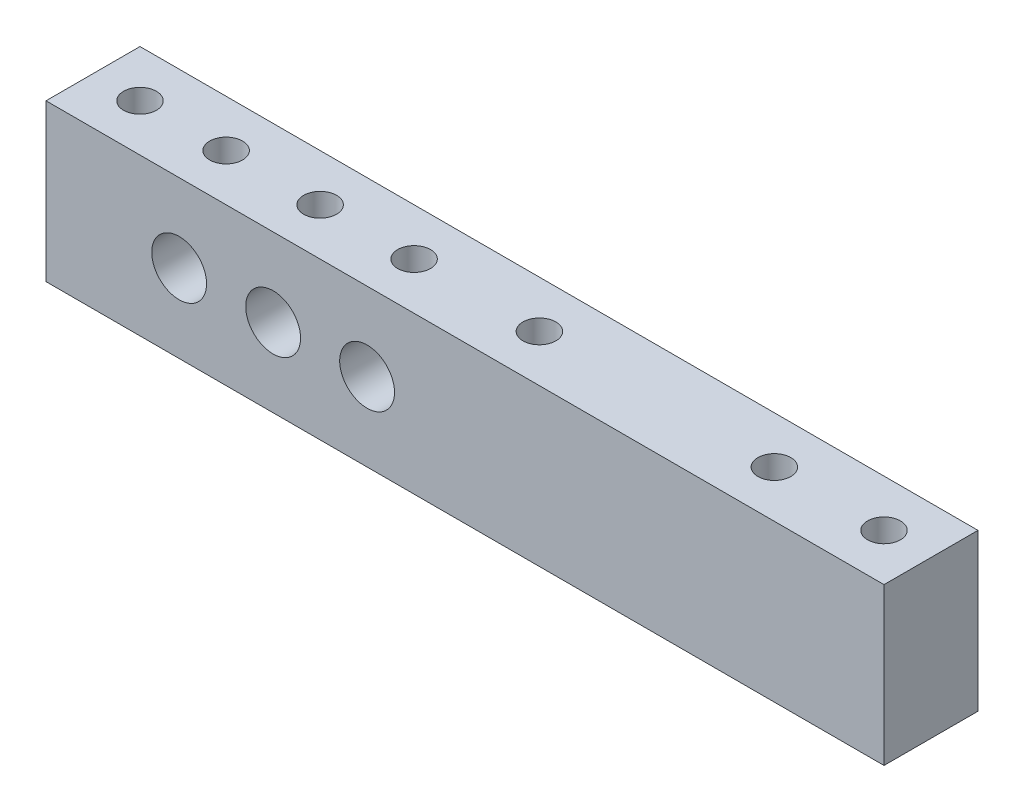
from build123d import *

# Parameters (mm, degrees)
SKIZZE1_W                       = 107
SKIZZE1_H                       = 20
AUFSATZ_LINEAR_AUSTRAGEN1_DEPTH = 12
F_7_0_7_DURCHMESSER_BOHRUNG1_D  = 7
M5_GEWINDEBOHRUNG1_D            = 4.2
M5_GEWINDEBOHRUNG2_D            = 4.2
M5_GEWINDEBOHRUNG2_DEPTH        = 10
M5_GEWINDEBOHRUNG2_TIP          = 1.2618073


with BuildPart() as part:
    # Skizze1 → Aufsatz-Linear austragen1 (new body)
    with BuildSketch(Plane.XY):
        with Locations((53.5, 10)):
            Rectangle(SKIZZE1_W, SKIZZE1_H)
    extrude(amount=AUFSATZ_LINEAR_AUSTRAGEN1_DEPTH)

    # Ø7.0 (7) Durchmesser Bohrung1 (through all)
    with Locations(Plane.XY.offset(12)):
        with Locations((17, 10), (29, 10), (41, 10)):
            Hole(F_7_0_7_DURCHMESSER_BOHRUNG1_D / 2)

    # M5 Gewindebohrung1 (through all)
    with Locations(Plane(origin=(0, 20, 0), x_dir=(1, 0, 0), z_dir=(0, 1, 0))):
        with Locations((6, -6), (101, -6), (87, -6), (57, -6)):
            Hole(M5_GEWINDEBOHRUNG1_D / 2)

    # M5 Gewindebohrung2
    with Locations(Plane(origin=(0, 20, 0), x_dir=(1, 0, 0), z_dir=(0, 1, 0))):
        with Locations((17, -6), (29, -6), (41, -6)):
            Hole(M5_GEWINDEBOHRUNG2_D / 2, depth=M5_GEWINDEBOHRUNG2_DEPTH)
            with Locations((0, 0, -(M5_GEWINDEBOHRUNG2_DEPTH + M5_GEWINDEBOHRUNG2_TIP / 2))):  # 118° drill point
                Cone(0, M5_GEWINDEBOHRUNG2_D / 2, M5_GEWINDEBOHRUNG2_TIP, mode=Mode.SUBTRACT)


solid = part.part
